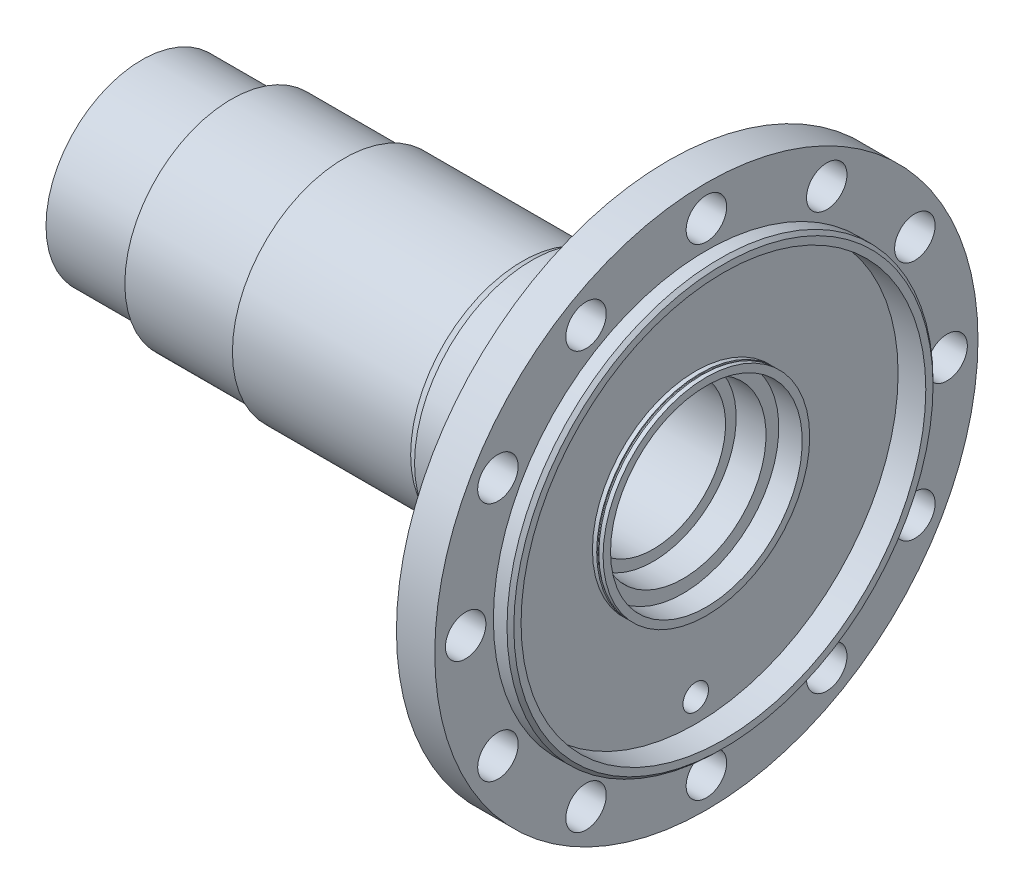
from build123d import *

# Parameters (mm, degrees)
SKETCH_3_W           = 2
SKETCH_3_H           = 46.5
SKETCH_5_W           = 2
SKETCH_5_H           = 46.5
SKETCH_6_R           = 9.5
CUT_EXTRUDE_1_DEPTH  = 328.171973127
SKETCH_7_R           = 9.5
CUT_EXTRUDE_2_DEPTH  = 328.171973127
SKETCH_8_R           = 9.5
CUT_EXTRUDE_3_DEPTH  = 328.171973127
SKETCH_9_R           = 9.5
CUT_EXTRUDE_4_DEPTH  = 328.171973127
SKETCH_10_R          = 9.5
CUT_EXTRUDE_5_DEPTH  = 328.171973127
SKETCH_11_R          = 9.5
CUT_EXTRUDE_6_DEPTH  = 328.171973127
SKETCH_12_R          = 9.5
CUT_EXTRUDE_7_DEPTH  = 328.171973127
SKETCH_13_R          = 9.5
CUT_EXTRUDE_8_DEPTH  = 328.171973127
SKETCH_14_R          = 9.5
CUT_EXTRUDE_9_DEPTH  = 328.171973127
SKETCH_15_R          = 9.5
CUT_EXTRUDE_10_DEPTH = 328.171973127
SKETCH_16_R          = 9.5
CUT_EXTRUDE_11_DEPTH = 328.171973127
SKETCH_17_R          = 9.5
CUT_EXTRUDE_12_DEPTH = 328.171973127
SKETCH_18_R          = 6
CUT_EXTRUDE_13_DEPTH = 328.171973127


with BuildPart() as part:
    # Эскиз1 → Повернуть1 (revolve)
    with BuildSketch(Plane.XY, mode=Mode.PRIVATE) as revolve_1_sk:
        Polygon((0, 0), (273, 0), (273, 98.4), (271.4, 100), (265, 100), (265, 127.5), (247, 127.5), (247, 100), (239, 100), (239, 62.5), (215, 62.5), (215, 55), (183, 55), (178.669872981, 52.5), (95, 52.5), (95, 50), (42, 50), (42, 45), (0, 45), align=None)
    revolve(revolve_1_sk.sketch.rotate(Axis((0, 0, 0), (1, 0, 0)), 90), axis=Axis((0, 0, 0), (1, 0, 0)))

    # Эскиз2 → Вырез-Повернуть1 (revolve, cut)
    with BuildSketch(Plane.XY, mode=Mode.PRIVATE) as cut_revolve_1_sk:
        Polygon((0, 0), (273, 0), (273, 95), (265, 95), (265, 45), (254, 45), (254, 39), (240, 39), (240, 34), (203.5, 34), (203.5, 31), (0, 31), align=None)
    revolve(cut_revolve_1_sk.sketch.rotate(Axis((0, 0, 0), (1, 0, 0)), 90), axis=Axis((0, 0, 0), (1, 0, 0)), mode=Mode.SUBTRACT)

    # Эскиз3 → Rear_recess_left (revolve, cut)
    with BuildSketch(Plane.XY, mode=Mode.PRIVATE) as rear_recess_left_sk:
        with Locations((261, 71.75)):
            Rectangle(SKETCH_3_W, SKETCH_3_H)
    revolve(rear_recess_left_sk.sketch.rotate(Axis((0, 0, 0), (1, 0, 0)), 90), axis=Axis((0, 0, 0), (1, 0, 0)), mode=Mode.SUBTRACT)

    # Эскиз4 → Collar_groove_nominal (revolve, cut)
    with BuildSketch(Plane.XY, mode=Mode.PRIVATE) as collar_groove_nominal_sk:
        with BuildLine():
            Line((263, 48), (263, 95))
            Line((263, 95), (262, 95))
            Line((262, 95), (262, 48))
            ThreePointArc((262, 48), (262.146446609, 47.646446609), (262.5, 47.5))
            ThreePointArc((262.5, 47.5), (262.853553391, 47.646446609), (263, 48))
        make_face()
    revolve(collar_groove_nominal_sk.sketch.rotate(Axis((0, 0, 0), (1, 0, 0)), 90), axis=Axis((0, 0, 0), (1, 0, 0)), mode=Mode.SUBTRACT)

    # Эскиз5 → Rear_recess_lip (revolve, cut)
    with BuildSketch(Plane.XY, mode=Mode.PRIVATE) as rear_recess_lip_sk:
        with Locations((264, 71.75)):
            Rectangle(SKETCH_5_W, SKETCH_5_H)
    revolve(rear_recess_lip_sk.sketch.rotate(Axis((0, 0, 0), (1, 0, 0)), 90), axis=Axis((0, 0, 0), (1, 0, 0)), mode=Mode.SUBTRACT)

    # Эскиз6 → Вырез-Вытянуть1 (cut, through all)
    with BuildSketch(Plane(origin=(0, 0, 0), x_dir=(0, 0, -1), z_dir=(1, 0, 0))):
        with Locations(Location((0, 113, 0), (0, 0, 180))):
            Circle(SKETCH_6_R)
    extrude(amount=CUT_EXTRUDE_1_DEPTH, mode=Mode.SUBTRACT)

    # Эскиз7 → Вырез-Вытянуть2 (cut, through all)
    with BuildSketch(Plane(origin=(0, 0, 0), x_dir=(0, 0, -1), z_dir=(1, 0, 0))):
        with Locations(Location((-56.5, 97.860870628, 0), (0, 0, 180))):
            Circle(SKETCH_7_R)
    extrude(amount=CUT_EXTRUDE_2_DEPTH, mode=Mode.SUBTRACT)

    # Эскиз8 → Вырез-Вытянуть3 (cut, through all)
    with BuildSketch(Plane(origin=(0, 0, 0), x_dir=(0, 0, -1), z_dir=(1, 0, 0))):
        with Locations(Location((-97.860870628, 56.5, 0), (0, 0, 180))):
            Circle(SKETCH_8_R)
    extrude(amount=CUT_EXTRUDE_3_DEPTH, mode=Mode.SUBTRACT)

    # Эскиз9 → Вырез-Вытянуть4 (cut, through all)
    with BuildSketch(Plane(origin=(0, 0, 0), x_dir=(0, 0, -1), z_dir=(1, 0, 0))):
        with Locations(Location((-113, 0, 0), (0, 0, 180))):
            Circle(SKETCH_9_R)
    extrude(amount=CUT_EXTRUDE_4_DEPTH, mode=Mode.SUBTRACT)

    # Эскиз10 → Вырез-Вытянуть5 (cut, through all)
    with BuildSketch(Plane(origin=(0, 0, 0), x_dir=(0, 0, -1), z_dir=(1, 0, 0))):
        with Locations(Location((-97.860870628, -56.5, 0), (0, 0, 180))):
            Circle(SKETCH_10_R)
    extrude(amount=CUT_EXTRUDE_5_DEPTH, mode=Mode.SUBTRACT)

    # Эскиз11 → Вырез-Вытянуть6 (cut, through all)
    with BuildSketch(Plane(origin=(0, 0, 0), x_dir=(0, 0, -1), z_dir=(1, 0, 0))):
        with Locations(Location((-56.5, -97.860870628, 0), (0, 0, 180))):
            Circle(SKETCH_11_R)
    extrude(amount=CUT_EXTRUDE_6_DEPTH, mode=Mode.SUBTRACT)

    # Эскиз12 → Вырез-Вытянуть7 (cut, through all)
    with BuildSketch(Plane(origin=(0, 0, 0), x_dir=(0, 0, -1), z_dir=(1, 0, 0))):
        with Locations(Location((0, -113, 0), (0, 0, 180))):
            Circle(SKETCH_12_R)
    extrude(amount=CUT_EXTRUDE_7_DEPTH, mode=Mode.SUBTRACT)

    # Эскиз13 → Вырез-Вытянуть8 (cut, through all)
    with BuildSketch(Plane(origin=(0, 0, 0), x_dir=(0, 0, -1), z_dir=(1, 0, 0))):
        with Locations(Location((56.5, -97.860870628, 0), (0, 0, 180))):
            Circle(SKETCH_13_R)
    extrude(amount=CUT_EXTRUDE_8_DEPTH, mode=Mode.SUBTRACT)

    # Эскиз14 → Вырез-Вытянуть9 (cut, through all)
    with BuildSketch(Plane(origin=(0, 0, 0), x_dir=(0, 0, -1), z_dir=(1, 0, 0))):
        with Locations(Location((97.860870628, -56.5, 0), (0, 0, 180))):
            Circle(SKETCH_14_R)
    extrude(amount=CUT_EXTRUDE_9_DEPTH, mode=Mode.SUBTRACT)

    # Эскиз15 → Вырез-Вытянуть10 (cut, through all)
    with BuildSketch(Plane(origin=(0, 0, 0), x_dir=(0, 0, -1), z_dir=(1, 0, 0))):
        with Locations(Location((113, 0, 0), (0, 0, 180))):
            Circle(SKETCH_15_R)
    extrude(amount=CUT_EXTRUDE_10_DEPTH, mode=Mode.SUBTRACT)

    # Эскиз16 → Вырез-Вытянуть11 (cut, through all)
    with BuildSketch(Plane(origin=(0, 0, 0), x_dir=(0, 0, -1), z_dir=(1, 0, 0))):
        with Locations(Location((97.860870628, 56.5, 0), (0, 0, 180))):
            Circle(SKETCH_16_R)
    extrude(amount=CUT_EXTRUDE_11_DEPTH, mode=Mode.SUBTRACT)

    # Эскиз17 → Вырез-Вытянуть12 (cut, through all)
    with BuildSketch(Plane(origin=(0, 0, 0), x_dir=(0, 0, -1), z_dir=(1, 0, 0))):
        with Locations(Location((56.5, 97.860870628, 0), (0, 0, 180))):
            Circle(SKETCH_17_R)
    extrude(amount=CUT_EXTRUDE_12_DEPTH, mode=Mode.SUBTRACT)

    # Эскиз18 → Вырез-Вытянуть13 (cut, through all)
    with BuildSketch(Plane(origin=(0, 0, 0), x_dir=(0, 0, -1), z_dir=(1, 0, 0))):
        with Locations((0, -84)):
            Circle(SKETCH_18_R)
    extrude(amount=CUT_EXTRUDE_13_DEPTH, mode=Mode.SUBTRACT)


solid = part.part
